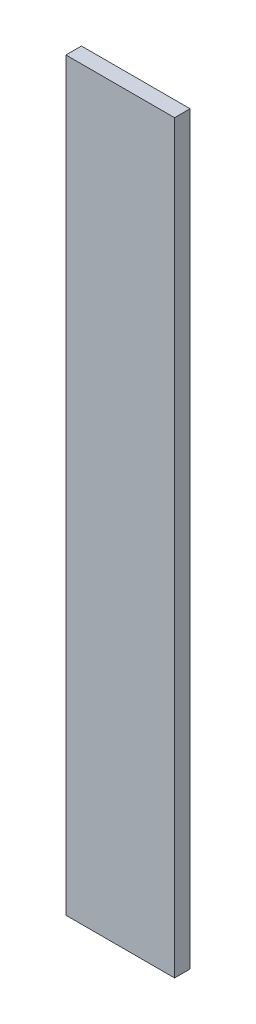
from build123d import *

# Parameters (mm, degrees)
SKETCH1_W           = 44.45
SKETCH1_H           = 6.35
BOSS_EXTRUDE1_DEPTH = 304.8


with BuildPart() as part:
    # Sketch1 → Boss-Extrude1 (new body)
    with BuildSketch(Plane(origin=(0, 0, 0), x_dir=(1, 0, 0), z_dir=(0, 1, 0))):
        with Locations((22.225, 3.175)):
            Rectangle(SKETCH1_W, SKETCH1_H)
    extrude(amount=BOSS_EXTRUDE1_DEPTH)


solid = part.part
